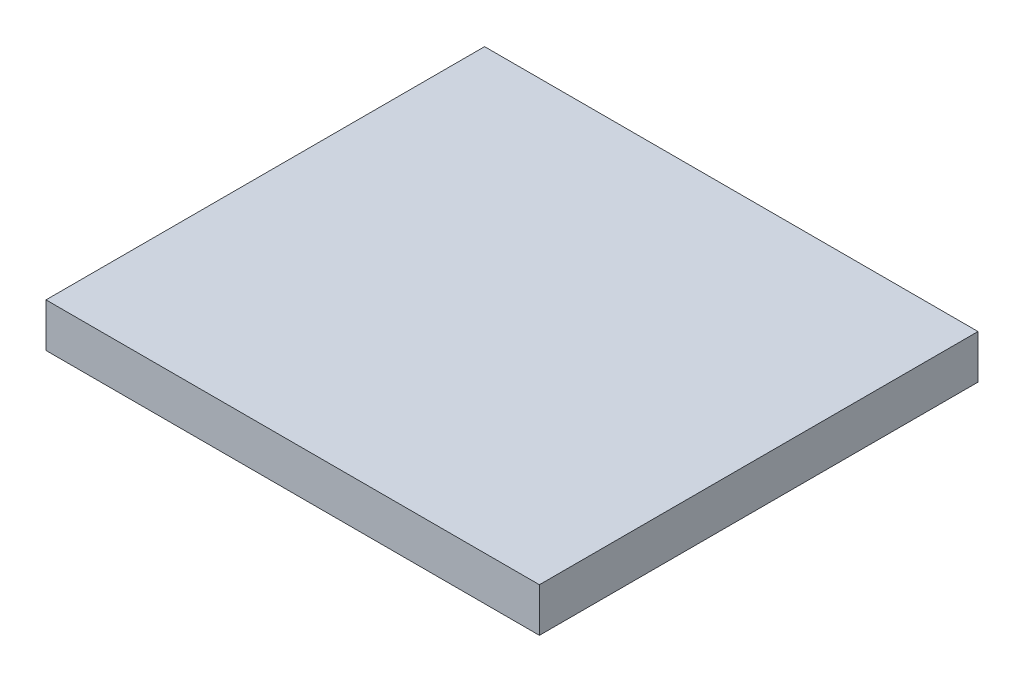
from build123d import *

# Parameters (mm, degrees)
SKIZZE1_W                       = 18
SKIZZE1_H                       = 16
AUFSATZ_LINEAR_AUSTRAGEN1_DEPTH = 1.6


with BuildPart() as part:
    # Skizze1 → Aufsatz-Linear austragen1 (new body)
    with BuildSketch(Plane(origin=(0, 0, 0), x_dir=(1, 0, 0), z_dir=(0, 1, 0))):
        Rectangle(SKIZZE1_W, SKIZZE1_H)
    extrude(amount=AUFSATZ_LINEAR_AUSTRAGEN1_DEPTH)


solid = part.part
